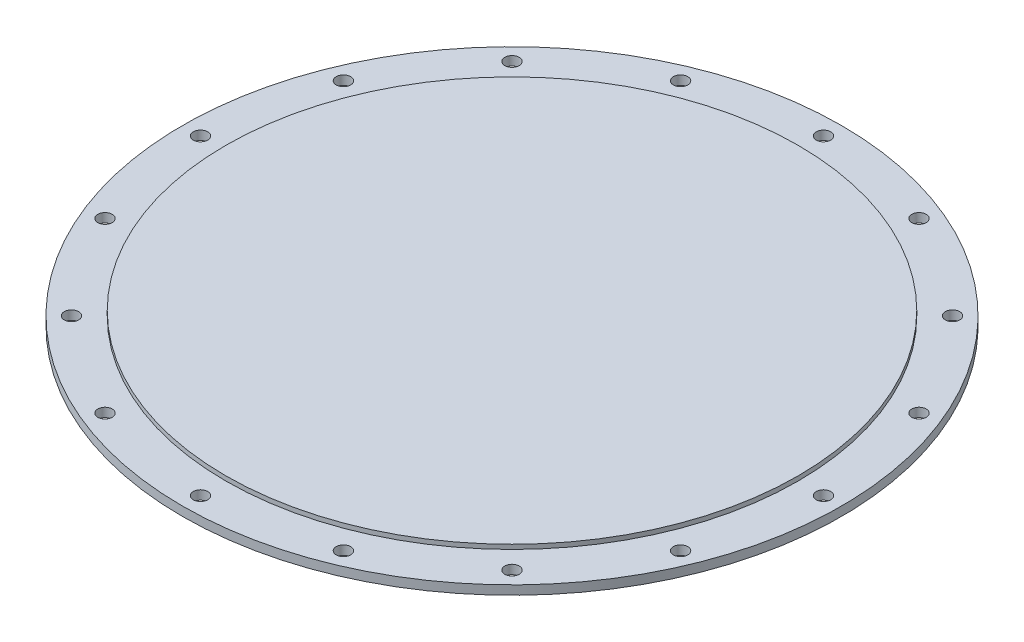
from build123d import *

# Parameters (mm, degrees)
SKETCH2_R          = 8
CUT_EXTRUDE1_DEPTH = 517.284805122


with BuildPart() as part:
    # Sketch1 → Revolve1 (revolve)
    with BuildSketch(Plane(origin=(0, 0, 0), x_dir=(0, 0, -1), z_dir=(1, 0, 0)), mode=Mode.PRIVATE) as revolve1_sk:
        Polygon((-365, 19.995973642), (-365, 9.995973642), (0, 9.995973642), (0, 24.995973642), (-317, 24.995973642), (-317, 19.995973642), align=None)
    revolve(revolve1_sk.sketch.rotate(Axis((0, 9.995973642, 0), (0, 1, 0)), 180), axis=Axis((0, 9.995973642, 0), (0, 1, 0)))

    # Sketch2 → Cut-Extrude1 (cut, through all)
    with BuildSketch(Plane(origin=(0, 19.995973642, 0), x_dir=(1, 0, 0), z_dir=(0, 1, 0))):
        with Locations(Location((0, 345, 0), (0, 0, 270))):
            Circle(SKETCH2_R)
        with Locations(Location((132.025784166, 318.738438716, 0), (0, 0, 270))):
            Circle(SKETCH2_R)
        with Locations(Location((243.951839509, 243.951839509, 0), (0, 0, 270))):
            Circle(SKETCH2_R)
        with Locations(Location((318.738438716, 132.025784166, 0), (0, 0, 270))):
            Circle(SKETCH2_R)
        with Locations(Location((345, 0, 0), (0, 0, 270))):
            Circle(SKETCH2_R)
        with Locations(Location((318.738438716, -132.025784166, 0), (0, 0, 270))):
            Circle(SKETCH2_R)
        with Locations(Location((243.951839509, -243.951839509, 0), (0, 0, 270))):
            Circle(SKETCH2_R)
        with Locations(Location((132.025784166, -318.738438716, 0), (0, 0, 270))):
            Circle(SKETCH2_R)
        with Locations(Location((0, -345, 0), (0, 0, 270))):
            Circle(SKETCH2_R)
        with Locations(Location((-132.025784166, -318.738438716, 0), (0, 0, 270))):
            Circle(SKETCH2_R)
        with Locations(Location((-243.951839509, -243.951839509, 0), (0, 0, 270))):
            Circle(SKETCH2_R)
        with Locations(Location((-318.738438716, -132.025784166, 0), (0, 0, 270))):
            Circle(SKETCH2_R)
        with Locations(Location((-345, 0, 0), (0, 0, 270))):
            Circle(SKETCH2_R)
        with Locations(Location((-318.738438716, 132.025784166, 0), (0, 0, 270))):
            Circle(SKETCH2_R)
        with Locations(Location((-243.951839509, 243.951839509, 0), (0, 0, 270))):
            Circle(SKETCH2_R)
        with Locations(Location((-132.025784166, 318.738438716, 0), (0, 0, 270))):
            Circle(SKETCH2_R)
    extrude(amount=-CUT_EXTRUDE1_DEPTH, mode=Mode.SUBTRACT)


solid = part.part
